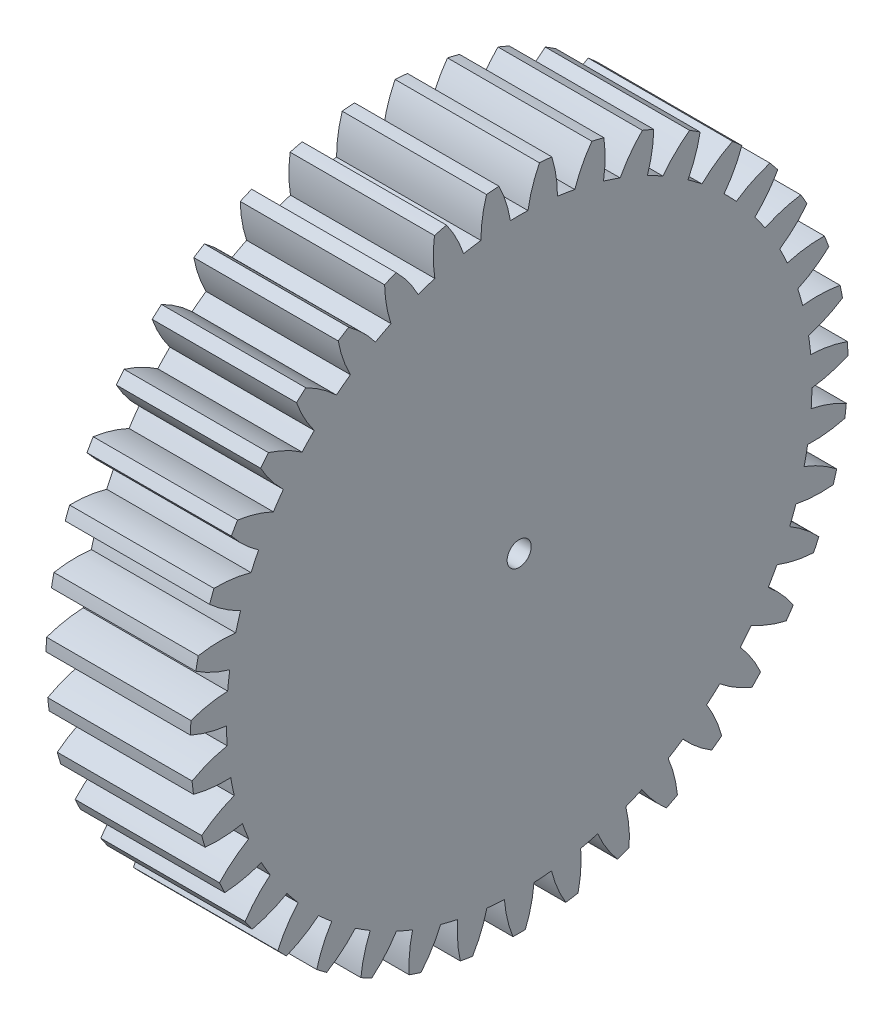
from build123d import *

# Parameters (mm, degrees)
BASPROSKE_W     = 19.05
BASPROSKE_H     = 43.391666667
TOOTHCUT_DEPTH  = 65.253995769
TEETHCUTS_COUNT = 39
TEETHCUTS_ANGLE = 350.769230769
BORSKE_R        = 1.5875
BORE_DEPTH      = 50.8000508


with BuildPart() as part:
    # BasProSke → Base-Revolve (revolve)
    with BuildSketch(Plane(origin=(0, 0, 0), x_dir=(1, 0, 0), z_dir=(0, 1, 0)), mode=Mode.PRIVATE) as base_revolve_sk:
        with Locations((9.525, 21.695833334)):
            Rectangle(BASPROSKE_W, BASPROSKE_H)
    revolve(base_revolve_sk.sketch.rotate(Axis((-10, 0, 0), (1, 0, 0)), 180), axis=Axis((-10, 0, 0), (1, 0, 0)))

    # TooCutSke → ToothCut (cut, through all)
    with BuildSketch(Plane(origin=(0, 0, 0), x_dir=(0, 0, -1), z_dir=(1, 0, 0))):
        with BuildLine():
            ThreePointArc((1.15791374, 38.610537897), (0, 38.627896667), (-1.15791374, 38.610537897))
            ThreePointArc((-1.15791374, 38.610537897), (-1.743415599, 41.029983551), (-2.686014438, 43.333901329))
            ThreePointArc((-2.686014438, 43.333901329), (0, 43.417066667), (2.686014438, 43.333901329))
            ThreePointArc((2.686014438, 43.333901329), (1.743415599, 41.029983551), (1.15791374, 38.610537897))
        make_face()
    toothcut = extrude(amount=TOOTHCUT_DEPTH, mode=Mode.SUBTRACT)

    # TeethCuts: ToothCut ×39 about axis
    teethcuts_axis = Axis((-10, 0, 0), (1, 0, 0))
    for i in range(1, TEETHCUTS_COUNT):
        add(toothcut.rotate(teethcuts_axis, i * TEETHCUTS_ANGLE / (TEETHCUTS_COUNT - 1)), mode=Mode.SUBTRACT)

    # BorSke → Bore (cut, symmetric)
    with BuildSketch(Plane(origin=(0, 0, 0), x_dir=(0, 0, -1), z_dir=(1, 0, 0))):
        with Locations(Location((0, 0, 0), (0, 0, 180))):
            Circle(BORSKE_R)
    extrude(amount=BORE_DEPTH, both=True, mode=Mode.SUBTRACT)


solid = part.part
